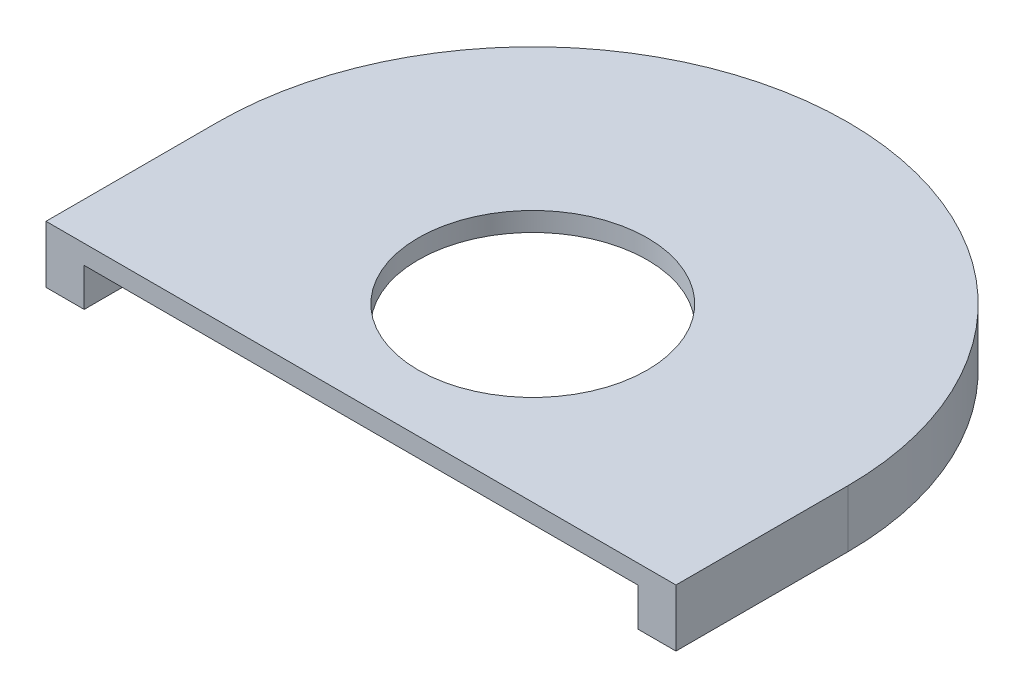
from build123d import *

# Parameters (mm, degrees)
SKETCH1_R               = 14.5
SKETCH1_R_2             = 6
BOSS_EXTRUDE1_DEPTH     = 1
BOSS_EXTRUDE2_START     = -3
BOSS_EXTRUDE2_DEPTH     = 3
CUT_EXTRUDE1_DEPTH      = 24.526580712
CUT_EXTRUDE1_DEPTH_BACK = 24.526580712
SKETCH3_W               = 29
SKETCH3_H               = 5.5


with BuildPart() as part:
    # Sketch1 → Boss-Extrude1 (new body)
    # profile 1 of 3: a face of its own
    with BuildSketch(Plane(origin=(0, 0, 0), x_dir=(1, 0, 0), z_dir=(0, 1, 0))):
        Circle(SKETCH1_R)
        with Locations(Location((0, 0, 0), (0, 0, 270))):
            Circle(SKETCH1_R_2, mode=Mode.SUBTRACT)
    # profile 2 of 3: a face of its own
    with BuildSketch(Plane(origin=(0, 0, 0), x_dir=(1, 0, 0), z_dir=(0, 1, 0))):
        with BuildLine():
            ThreePointArc((0, -14.5), (-10.253048327, -10.253048327), (-14.5, 0))
            Line((-14.5, 0), (-14.5, -14.5))
            Line((-14.5, -14.5), (0, -14.5))
        make_face()
    # profile 3 of 3: a face of its own
    with BuildSketch(Plane(origin=(0, 0, 0), x_dir=(1, 0, 0), z_dir=(0, 1, 0))):
        with BuildLine():
            Line((14.5, -14.5), (14.5, 0))
            ThreePointArc((14.5, 0), (10.253048327, -10.253048327), (0, -14.5))
            Line((0, -14.5), (14.5, -14.5))
        make_face()
    extrude(amount=BOSS_EXTRUDE1_DEPTH)

    # Sketch2 → Boss-Extrude2 (add)
    with BuildSketch(Plane(origin=(0, 1, 0), x_dir=(1, 0, 0), z_dir=(0, 1, 0)).offset(BOSS_EXTRUDE2_START)):
        with BuildLine():
            ThreePointArc((7.874007874, -14.5), (4.062019223, -15.992185587), (4.2e-08, -16.5))
            Line((4.2e-08, -16.5), (16.5, -16.5))
            Line((16.5, -16.5), (16.5, 0))
            ThreePointArc((16.5, 0), (15.992185592, -4.062019202), (14.5, -7.874007874))
            Line((14.5, -7.874007874), (14.5, -14.5))
            Line((14.5, -14.5), (7.874007874, -14.5))
        make_face()
        with BuildLine():
            ThreePointArc((-7.874007874, -14.5), (-4.062019182, -15.992185597), (4.2e-08, -16.5))
            ThreePointArc((4.2e-08, -16.5), (4.062019223, -15.992185587), (7.874007874, -14.5))
            Line((7.874007874, -14.5), (-7.874007874, -14.5))
        make_face()
        with BuildLine():
            ThreePointArc((-14.5, -7.874007874), (-15.992185592, -4.062019202), (-16.5, 0))
            Line((-16.5, 0), (-16.5, -16.5))
            Line((-16.5, -16.5), (4.2e-08, -16.5))
            ThreePointArc((4.2e-08, -16.5), (-4.062019182, -15.992185597), (-7.874007874, -14.5))
            Line((-7.874007874, -14.5), (-14.5, -14.5))
            Line((-14.5, -14.5), (-14.5, -7.874007874))
        make_face()
        with BuildLine():
            Line((-14.5, 0), (-16.5, 0))
            ThreePointArc((-16.5, 0), (-15.992185592, -4.062019202), (-14.5, -7.874007874))
            Line((-14.5, -7.874007874), (-14.5, 0))
        make_face()
        with BuildLine():
            Line((16.5, 0), (14.5, 0))
            Line((14.5, 0), (14.5, -7.874007874))
            ThreePointArc((14.5, -7.874007874), (15.992185592, -4.062019202), (16.5, 0))
        make_face()
        with BuildLine():
            ThreePointArc((3.4e-08, 16.5), (-11.667261877, 11.667261902), (-16.5, 0))
            Line((-16.5, 0), (-14.5, 0))
            ThreePointArc((-14.5, 0), (0, 14.5), (14.5, 0))
            Line((14.5, 0), (16.5, 0))
            ThreePointArc((16.5, 0), (11.667261902, 11.667261877), (3.4e-08, 16.5))
        make_face()
    extrude(amount=BOSS_EXTRUDE2_DEPTH)

    # Sketch3 → Cut-Extrude1 (cut, two sides: drawn at the far end of the back side and taken through both)
    with BuildSketch(Plane.XZ.offset(2).offset(-CUT_EXTRUDE1_DEPTH_BACK)):
        Polygon((16.5, 16.5), (-16.5, 16.5), (-16.5, 9), (-14.5, 9), (-14.5, 14.5), (14.5, 14.5), (14.5, 9), (16.5, 9), align=None)
        with Locations((0, 11.75)):
            Rectangle(SKETCH3_W, SKETCH3_H)
    extrude(amount=CUT_EXTRUDE1_DEPTH + CUT_EXTRUDE1_DEPTH_BACK, mode=Mode.SUBTRACT)


solid = part.part
